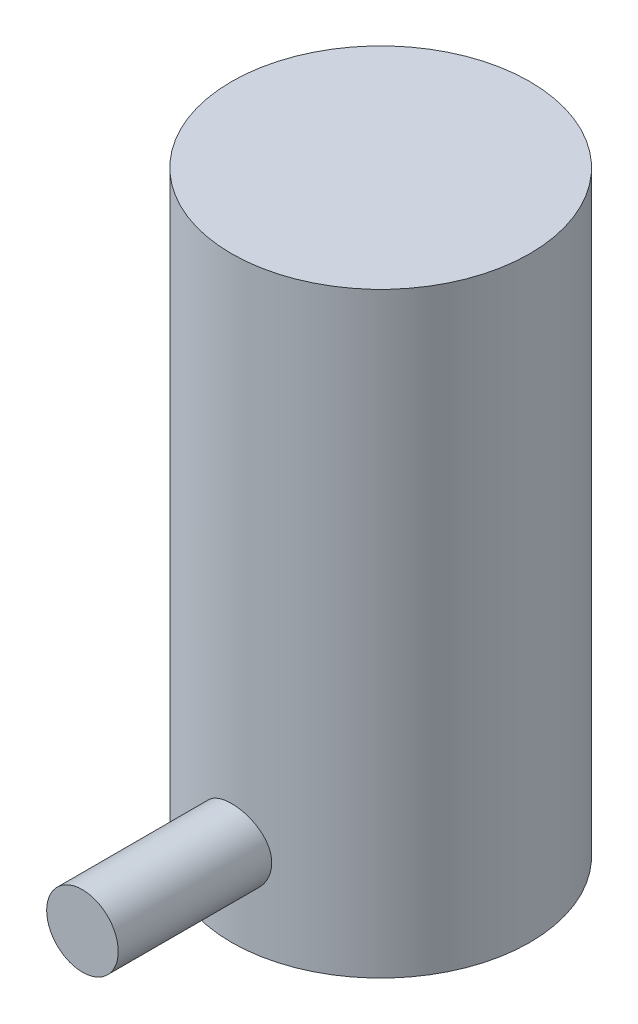
from build123d import *

# Parameters (mm, degrees)
SKETCH1_R           = 6.35
BOSS_EXTRUDE1_DEPTH = 25.4
SKETCH2_R           = 1.524
BOSS_EXTRUDE2_DEPTH = 12.7


with BuildPart() as part:
    # Sketch1 → Boss-Extrude1 (new body)
    with BuildSketch(Plane(origin=(0, 0, 0), x_dir=(1, 0, 0), z_dir=(0, 1, 0))):
        with Locations(Location((0, 0, 0), (0, 0, 270))):
            Circle(SKETCH1_R)
    extrude(amount=BOSS_EXTRUDE1_DEPTH)

    # Sketch2 → Boss-Extrude2 (add)
    with BuildSketch(Plane.XY):
        with Locations(Location((0, 3.599983776, 0), (0, 0, 180))):
            Circle(SKETCH2_R)
    extrude(amount=BOSS_EXTRUDE2_DEPTH)


solid = part.part
